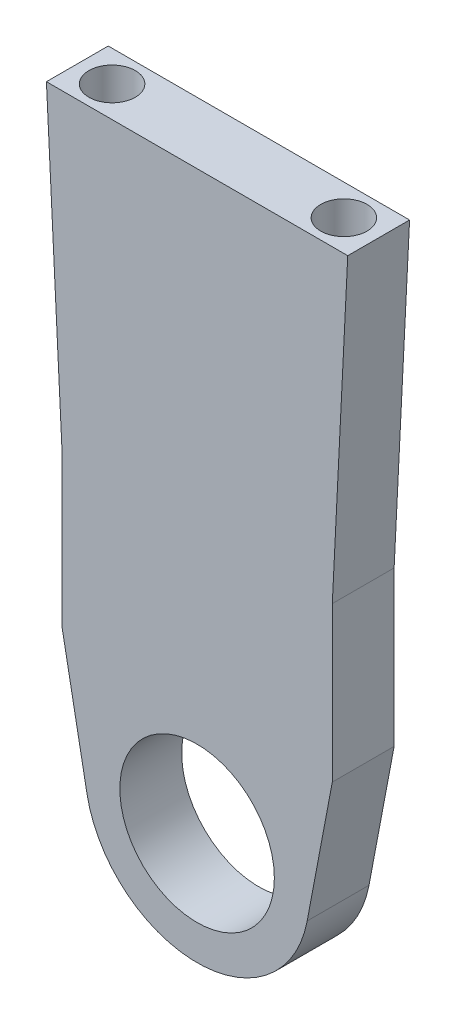
from build123d import *

# Parameters (mm, degrees)
SKETCH1_R           = 5
BOSS_EXTRUDE1_DEPTH = 2
SKETCH2_W           = 17.5
SKETCH2_H           = 4
BOSS_EXTRUDE2_DEPTH = 30
BOSS_EXTRUDE3_DEPTH = 2
SKETCH3_R           = 1.5
CUT_EXTRUDE1_DEPTH  = 6


with BuildPart() as part:
    # Sketch1 → Boss-Extrude1 (new, symmetric)
    with BuildSketch(Plane.XY):
        with BuildLine():
            Line((8.75, 7.25), (-8.75, 7.25))
            Line((-8.75, 7.25), (-7.123668925, -1.347531462))
            ThreePointArc((-7.123668925, -1.347531462), (0, -7.25), (7.123668925, -1.347531462))
            Line((7.123668925, -1.347531462), (8.75, 7.25))
        make_face()
        Circle(SKETCH1_R, mode=Mode.SUBTRACT)
    extrude(amount=BOSS_EXTRUDE1_DEPTH, both=True)

    # Sketch2 → Boss-Extrude2 (add)
    with BuildSketch(Plane(origin=(0, 7.25, 0), x_dir=(1, 0, 0), z_dir=(0, 1, 0))):
        Rectangle(SKETCH2_W, SKETCH2_H)
    extrude(amount=BOSS_EXTRUDE2_DEPTH)

    # Sketch4 → Boss-Extrude3 (add, symmetric)
    with BuildSketch(Plane.XY):
        Polygon((-8.75, 37.25), (-9.75, 37.25), (-8.75, 17.25), align=None)
        Polygon((8.75, 37.25), (9.75, 37.25), (8.75, 17.25), align=None)
    extrude(amount=BOSS_EXTRUDE3_DEPTH, both=True)

    # Sketch3 → Cut-Extrude1 (cut)
    with BuildSketch(Plane(origin=(0, 37.25, 0), x_dir=(1, 0, 0), z_dir=(0, 1, 0))):
        with Locations(Location((-7.5, 0, 0), (0, 0, 180))):
            Circle(SKETCH3_R)
        with Locations(Location((7.5, 0, 0), (0, 0, 180))):
            Circle(SKETCH3_R)
    extrude(amount=-CUT_EXTRUDE1_DEPTH, mode=Mode.SUBTRACT)


solid = part.part
